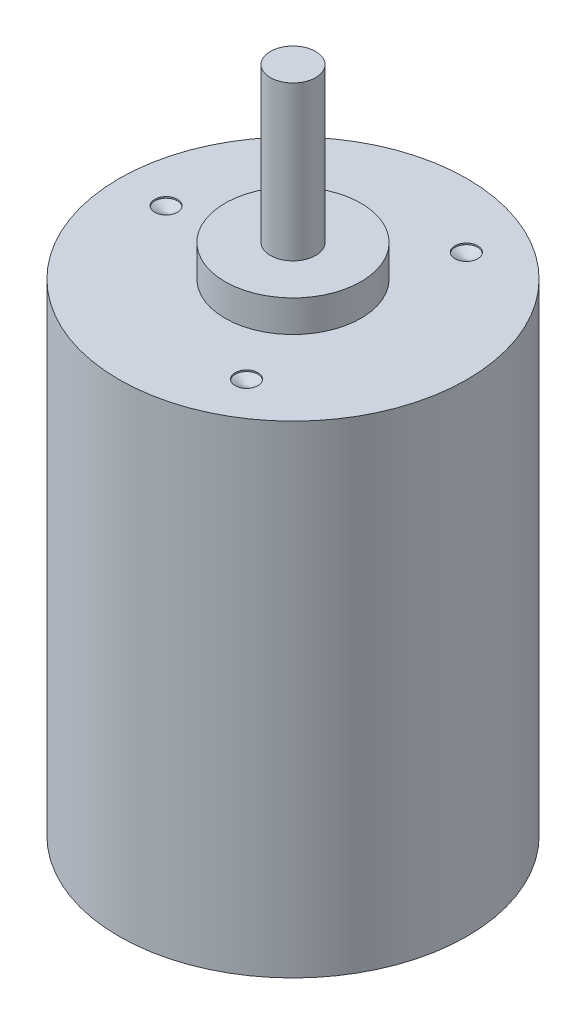
from build123d import *

# Parameters (mm, degrees)
M3_TAPPED_HOLE1_D     = 2.5
M3_TAPPED_HOLE1_DEPTH = 0.16
M3_TAPPED_HOLE1_TIP   = 0.751075774


with BuildPart() as part:
    # Sketch1 → Revolve1 (revolve)
    with BuildSketch(Plane(origin=(0, 0, 0), x_dir=(0, 0, -1), z_dir=(1, 0, 0)), mode=Mode.PRIVATE) as revolve1_sk:
        Polygon((0, 0), (19.2, 0), (19.2, 53.2), (7.5, 53.2), (7.5, 56.7), (2.5, 56.7), (2.5, 73.7), (0, 73.7), align=None)
    revolve(revolve1_sk.sketch.rotate(Axis((0, 33.970588235, 0), (0, -1, 0)), 180), axis=Axis((0, 33.970588235, 0), (0, -1, 0)))

    # M3 Tapped Hole1
    with Locations(Plane(origin=(0, 53.2, 0), x_dir=(1, 0, 0), z_dir=(0, 1, 0))):
        with Locations((7, 12.124355653), (7, -12.124355653), (-14, 0)):
            Hole(M3_TAPPED_HOLE1_D / 2, depth=M3_TAPPED_HOLE1_DEPTH)
            with Locations((0, 0, -(M3_TAPPED_HOLE1_DEPTH + M3_TAPPED_HOLE1_TIP / 2))):  # 118° drill point
                Cone(0, M3_TAPPED_HOLE1_D / 2, M3_TAPPED_HOLE1_TIP, mode=Mode.SUBTRACT)


solid = part.part
